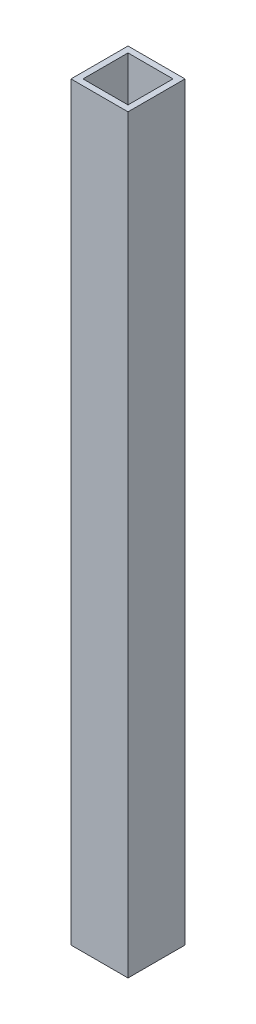
from build123d import *

# Parameters (mm, degrees)
SKETCH1_W           = 19
SKETCH1_H           = 19
SKETCH1_W_2         = 15
SKETCH1_H_2         = 15
BOSS_EXTRUDE1_DEPTH = 250


with BuildPart() as part:
    # Sketch1 → Boss-Extrude1 (new body)
    with BuildSketch(Plane(origin=(0, 0, 0), x_dir=(1, 0, 0), z_dir=(0, 1, 0))):
        Rectangle(SKETCH1_W, SKETCH1_H)
        Rectangle(SKETCH1_W_2, SKETCH1_H_2, mode=Mode.SUBTRACT)
    extrude(amount=BOSS_EXTRUDE1_DEPTH)


solid = part.part
